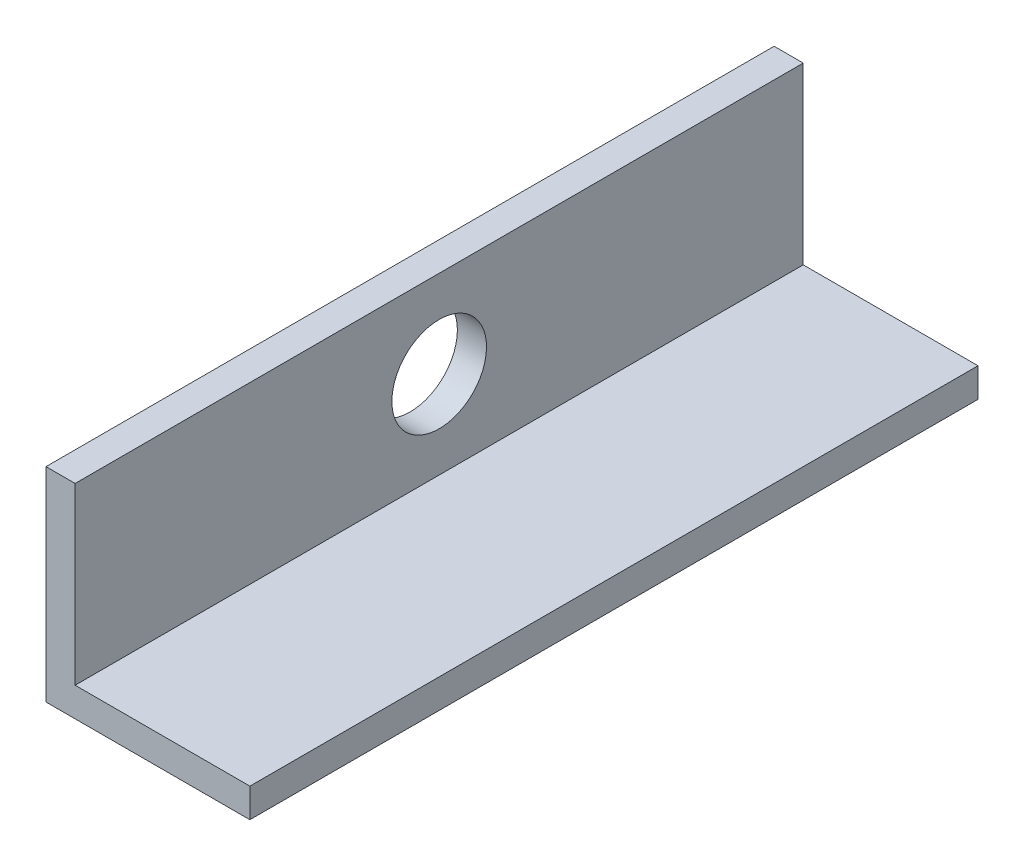
from build123d import *

# Parameters (mm, degrees)
EXTRUDE_1_DEPTH     = 50
SKETCH_2_R          = 3.25
CUT_EXTRUDE_1_DEPTH = 50


with BuildPart() as part:
    # Эскиз1 → Бобышка-Вытянуть1 (new body)
    with BuildSketch(Plane.XY):
        Polygon((0, 0), (0, 14), (2, 14), (2, 2), (14, 2), (14, 0), align=None)
    extrude(amount=EXTRUDE_1_DEPTH)

    # Эскиз2 → Вырез-Вытянуть1 (cut)
    with BuildSketch(Plane(origin=(2, 0, 0), x_dir=(0, 0, -1), z_dir=(1, 0, 0))):
        with Locations(Location((-25, 8, 0), (0, 0, 90))):
            Circle(SKETCH_2_R)
    extrude(amount=-CUT_EXTRUDE_1_DEPTH, mode=Mode.SUBTRACT)


solid = part.part
